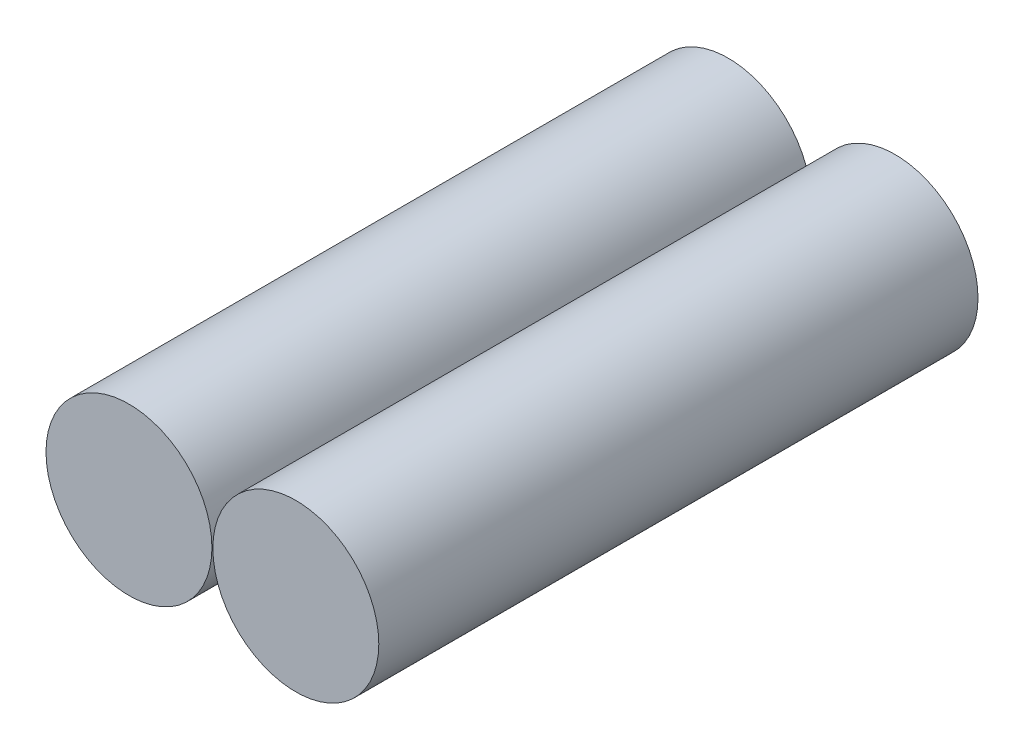
from build123d import *

# Parameters (mm, degrees)
SKETCH_1_R        = 9
EXTRUDE_1_DEPTH   = 65
EXTRUDE_1_2_DEPTH = 65


with BuildPart() as part:
    # 草图1 → 凸台-拉伸1 (new body)
    with BuildSketch(Plane.XY):
        Circle(SKETCH_1_R)
    extrude(amount=EXTRUDE_1_DEPTH)


with BuildPart() as body_2:
    # 草图1 → Extrude 1 2 (new body)
    with BuildSketch(Plane.XY):
        with Locations((18.1, 0)):
            Circle(SKETCH_1_R)
    extrude(amount=EXTRUDE_1_2_DEPTH)


solid = Compound([part.part, body_2.part])
